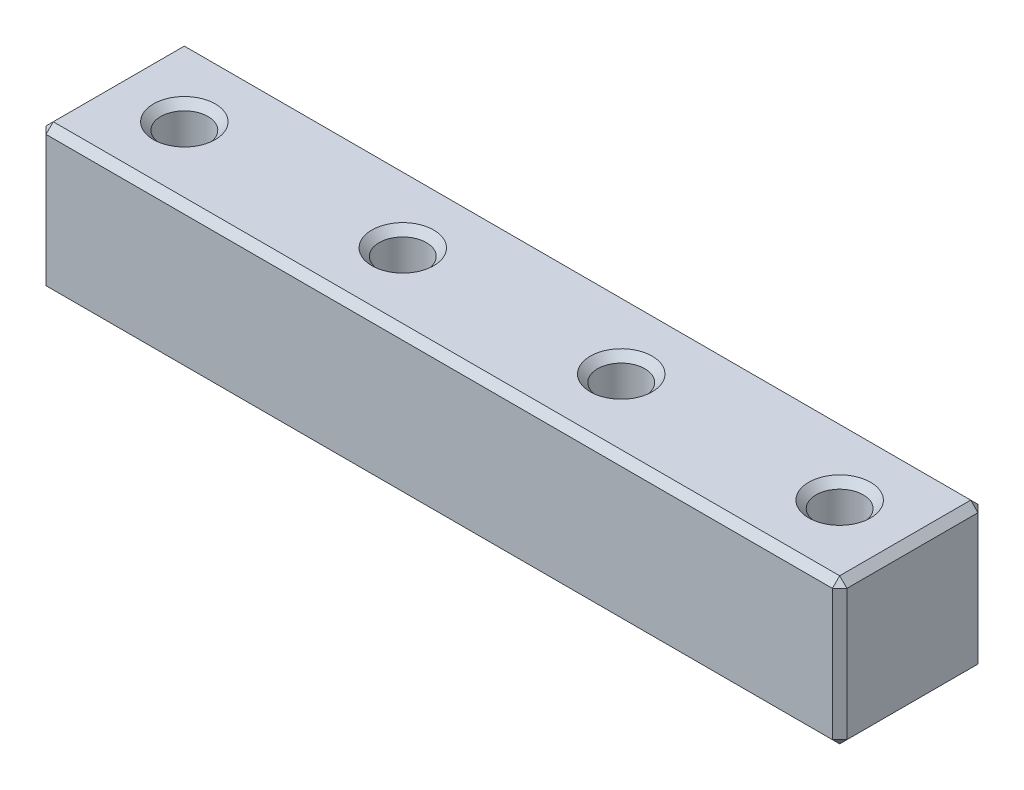
from build123d import *

# Parameters (mm, degrees)
SKETCH1_W           = 110
SKETCH1_H           = 20
SKETCH1_R           = 3.25
BOSS_EXTRUDE1_DEPTH = 20
CHAMFER1_SIZE       = 1


with BuildPart() as part:
    # Sketch1 → Boss-Extrude1 (new body)
    with BuildSketch(Plane(origin=(0, 0, 0), x_dir=(1, 0, 0), z_dir=(0, 1, 0))):
        Rectangle(SKETCH1_W, SKETCH1_H)
        with Locations(Location((-45, 0, 0), (0, 0, 270))):
            Circle(SKETCH1_R, mode=Mode.SUBTRACT)
        with Locations(Location((-15, 0, 0), (0, 0, 270))):
            Circle(SKETCH1_R, mode=Mode.SUBTRACT)
        with Locations(Location((15, 0, 0), (0, 0, 270))):
            Circle(SKETCH1_R, mode=Mode.SUBTRACT)
        with Locations(Location((45, 0, 0), (0, 0, 270))):
            Circle(SKETCH1_R, mode=Mode.SUBTRACT)
    extrude(amount=BOSS_EXTRUDE1_DEPTH)

    # Chamfer1
    chamfer1_edges = [part.edges().sort_by_distance(p)[0] for p in [
        (-45, 0, -3.25),
        (-45, 20, -3.25),
        (-55, 20, 0),
        (-15, 0, -3.25),
        (-15, 20, -3.25),
        (0, 20, 10),
        (15, 0, -3.25),
        (15, 20, -3.25),
        (45, 0, -3.25),
        (45, 20, -3.25),
        (55, 20, 0),
        (0, 0, 10),
        (-55, 0, 0),
        (0, 0, -10),
        (55, 0, 0),
        (55, 10, 10),
        (-55, 10, 10),
        (-55, 10, -10),
        (55, 10, -10),
        (0, 20, -10),
    ]]
    chamfer(chamfer1_edges, length=CHAMFER1_SIZE)


solid = part.part
